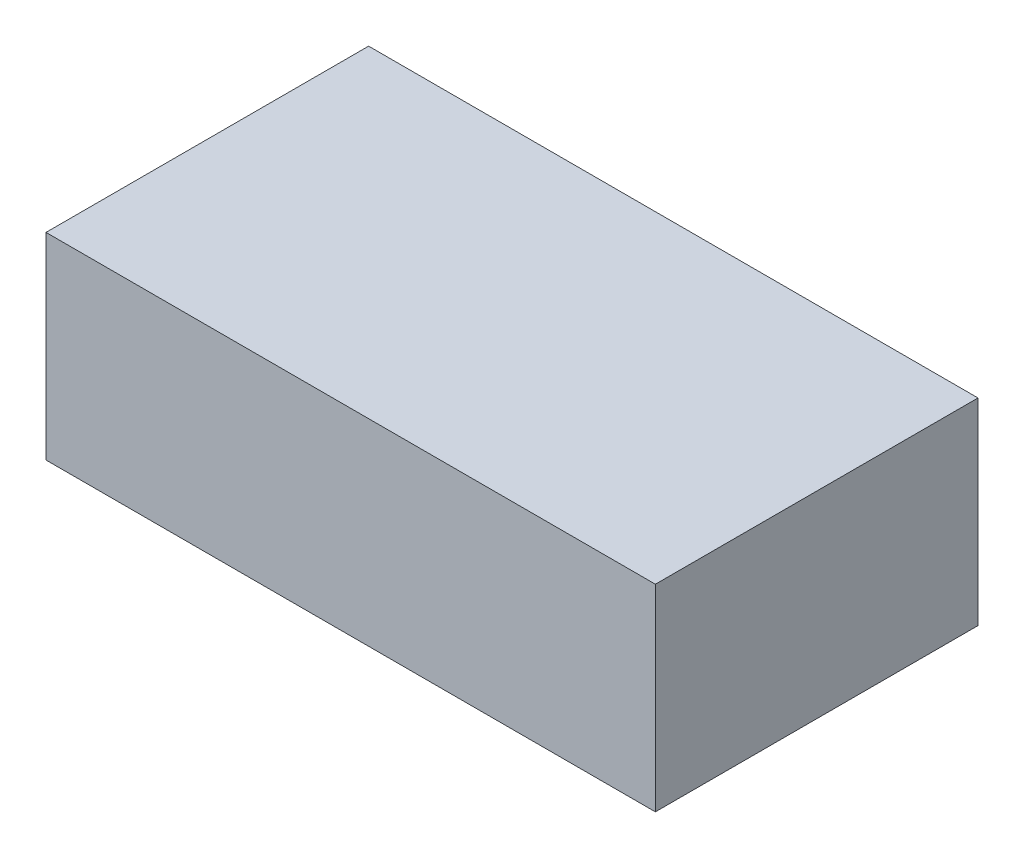
from build123d import *

# Parameters (mm, degrees)
SKETCH1_W           = 34
SKETCH1_H           = 18
BOSS_EXTRUDE1_DEPTH = 11


with BuildPart() as part:
    # Sketch1 → Boss-Extrude1 (new body)
    with BuildSketch(Plane(origin=(0, 17, 0), x_dir=(1, 0, 0), z_dir=(0, 1, 0))):
        with Locations((20, 14)):
            Rectangle(SKETCH1_W, SKETCH1_H)
    extrude(amount=BOSS_EXTRUDE1_DEPTH)


solid = part.part
